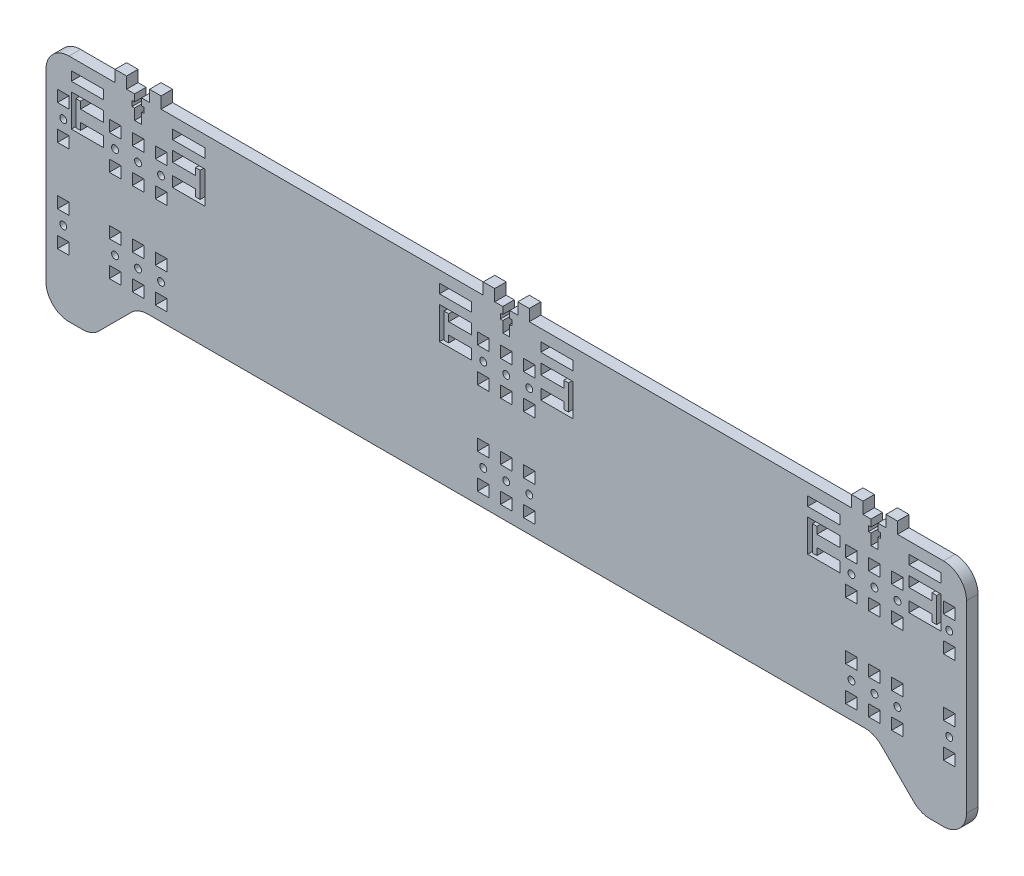
from build123d import *

# Parameters (mm, degrees)
SKETCH1_R           = 1.5
SKETCH1_W           = 5
SKETCH1_H           = 5
SKETCH1_W_2         = 14
SKETCH1_H_2         = 4
BOSS_EXTRUDE1_DEPTH = 5
CONG_1_R            = 10


with BuildPart() as part:
    # Sketch1 → Boss-Extrude1 (new body)
    with BuildSketch(Plane.XY):
        Polygon((1.5, 0), (5, 0), (5, 5), (10, 5), (10, 0), (150, 0), (150, 5), (155, 5), (155, 0), (158.5, 0), (158.5, -3), (157.4, -3), (157.4, -5.3), (158.5, -5.3), (158.5, -10), (161.5, -10), (161.5, -5.3), (162.6, -5.3), (162.6, -3), (161.5, -3), (161.5, 0), (165, 0), (165, 5), (170, 5), (170, 0), (200, 0), (200, -100), (180, -100), (160, -80), (-160, -80), (-180, -100), (-200, -100), (-200, 0), (-170, 0), (-170, 5), (-165, 5), (-165, 0), (-161.5, 0), (-161.5, -3), (-162.6, -3), (-162.6, -5.3), (-161.5, -5.3), (-161.5, -10), (-158.5, -10), (-158.5, -5.3), (-157.4, -5.3), (-157.4, -3), (-158.5, -3), (-158.5, 0), (-155, 0), (-155, 5), (-150, 5), (-150, 0), (-10, 0), (-10, 5), (-5, 5), (-5, 0), (-1.5, 0), (-1.5, -3), (-2.6, -3), (-2.6, -5.3), (-1.5, -5.3), (-1.5, -10), (1.5, -10), (1.5, -5.3), (2.6, -5.3), (2.6, -3), (1.5, -3), align=None)
        with Locations((150, -65)):
            Circle(SKETCH1_R, mode=Mode.SUBTRACT)
        with Locations((10, -65)):
            Circle(SKETCH1_R, mode=Mode.SUBTRACT)
        with Locations((-150, -65)):
            Circle(SKETCH1_R, mode=Mode.SUBTRACT)
        with Locations((-150, -25)):
            Circle(SKETCH1_R, mode=Mode.SUBTRACT)
        with Locations((10, -25)):
            Circle(SKETCH1_R, mode=Mode.SUBTRACT)
        with Locations((150, -25)):
            Circle(SKETCH1_R, mode=Mode.SUBTRACT)
        with Locations((192.5, -25)):
            Circle(SKETCH1_R, mode=Mode.SUBTRACT)
        with Locations((192.5, -65)):
            Circle(SKETCH1_R, mode=Mode.SUBTRACT)
        with Locations((-192.5, -65)):
            Circle(SKETCH1_R, mode=Mode.SUBTRACT)
        with Locations((-192.5, -25)):
            Circle(SKETCH1_R, mode=Mode.SUBTRACT)
        with Locations((170, -25)):
            Circle(SKETCH1_R, mode=Mode.SUBTRACT)
        with Locations((170, -65)):
            Circle(SKETCH1_R, mode=Mode.SUBTRACT)
        with Locations(Location((-10, -65, 0), (0, 0, 180))):
            Circle(SKETCH1_R, mode=Mode.SUBTRACT)
        with Locations(Location((-10, -25, 0), (0, 0, 180))):
            Circle(SKETCH1_R, mode=Mode.SUBTRACT)
        with Locations(Location((-170, -65, 0), (0, 0, 180))):
            Circle(SKETCH1_R, mode=Mode.SUBTRACT)
        with Locations(Location((-170, -25, 0), (0, 0, 180))):
            Circle(SKETCH1_R, mode=Mode.SUBTRACT)
        with Locations((0, -65)):
            Circle(SKETCH1_R, mode=Mode.SUBTRACT)
        with Locations((0, -25)):
            Circle(SKETCH1_R, mode=Mode.SUBTRACT)
        with Locations((-160, -25)):
            Circle(SKETCH1_R, mode=Mode.SUBTRACT)
        with Locations((-160, -65)):
            Circle(SKETCH1_R, mode=Mode.SUBTRACT)
        with Locations((160, -25)):
            Circle(SKETCH1_R, mode=Mode.SUBTRACT)
        with Locations((160, -65)):
            Circle(SKETCH1_R, mode=Mode.SUBTRACT)
        with Locations((150, -57.5)):
            Rectangle(SKETCH1_W, SKETCH1_H, mode=Mode.SUBTRACT)
        with Locations((150, -72.5)):
            Rectangle(SKETCH1_W, SKETCH1_H, mode=Mode.SUBTRACT)
        with Locations((10, -57.5)):
            Rectangle(SKETCH1_W, SKETCH1_H, mode=Mode.SUBTRACT)
        with Locations((10, -72.5)):
            Rectangle(SKETCH1_W, SKETCH1_H, mode=Mode.SUBTRACT)
        with Locations((-150, -57.5)):
            Rectangle(SKETCH1_W, SKETCH1_H, mode=Mode.SUBTRACT)
        with Locations((-150, -72.5)):
            Rectangle(SKETCH1_W, SKETCH1_H, mode=Mode.SUBTRACT)
        with Locations((-150, -17.5)):
            Rectangle(SKETCH1_W, SKETCH1_H, mode=Mode.SUBTRACT)
        with Locations((-150, -32.5)):
            Rectangle(SKETCH1_W, SKETCH1_H, mode=Mode.SUBTRACT)
        with Locations((10, -17.5)):
            Rectangle(SKETCH1_W, SKETCH1_H, mode=Mode.SUBTRACT)
        with Locations((10, -32.5)):
            Rectangle(SKETCH1_W, SKETCH1_H, mode=Mode.SUBTRACT)
        with Locations((150, -17.5)):
            Rectangle(SKETCH1_W, SKETCH1_H, mode=Mode.SUBTRACT)
        with Locations((150, -32.5)):
            Rectangle(SKETCH1_W, SKETCH1_H, mode=Mode.SUBTRACT)
        with Locations((192.5, -17.5)):
            Rectangle(SKETCH1_W, SKETCH1_H, mode=Mode.SUBTRACT)
        with Locations((192.5, -32.5)):
            Rectangle(SKETCH1_W, SKETCH1_H, mode=Mode.SUBTRACT)
        with Locations((192.5, -57.5)):
            Rectangle(SKETCH1_W, SKETCH1_H, mode=Mode.SUBTRACT)
        with Locations((192.5, -72.5)):
            Rectangle(SKETCH1_W, SKETCH1_H, mode=Mode.SUBTRACT)
        with Locations((-192.5, -57.5)):
            Rectangle(SKETCH1_W, SKETCH1_H, mode=Mode.SUBTRACT)
        with Locations((-192.5, -72.5)):
            Rectangle(SKETCH1_W, SKETCH1_H, mode=Mode.SUBTRACT)
        with Locations((-192.5, -17.5)):
            Rectangle(SKETCH1_W, SKETCH1_H, mode=Mode.SUBTRACT)
        with Locations((-192.5, -32.5)):
            Rectangle(SKETCH1_W, SKETCH1_H, mode=Mode.SUBTRACT)
        with Locations((170, -17.5)):
            Rectangle(SKETCH1_W, SKETCH1_H, mode=Mode.SUBTRACT)
        with Locations((170, -32.5)):
            Rectangle(SKETCH1_W, SKETCH1_H, mode=Mode.SUBTRACT)
        with Locations((170, -57.5)):
            Rectangle(SKETCH1_W, SKETCH1_H, mode=Mode.SUBTRACT)
        with Locations((170, -72.5)):
            Rectangle(SKETCH1_W, SKETCH1_H, mode=Mode.SUBTRACT)
        with Locations((-10, -57.5)):
            Rectangle(SKETCH1_W, SKETCH1_H, mode=Mode.SUBTRACT)
        with Locations((-10, -72.5)):
            Rectangle(SKETCH1_W, SKETCH1_H, mode=Mode.SUBTRACT)
        with Locations((-10, -17.5)):
            Rectangle(SKETCH1_W, SKETCH1_H, mode=Mode.SUBTRACT)
        with Locations((-10, -32.5)):
            Rectangle(SKETCH1_W, SKETCH1_H, mode=Mode.SUBTRACT)
        with Locations((-170, -57.5)):
            Rectangle(SKETCH1_W, SKETCH1_H, mode=Mode.SUBTRACT)
        with Locations((-170, -72.5)):
            Rectangle(SKETCH1_W, SKETCH1_H, mode=Mode.SUBTRACT)
        with Locations((-170, -17.5)):
            Rectangle(SKETCH1_W, SKETCH1_H, mode=Mode.SUBTRACT)
        with Locations((-170, -32.5)):
            Rectangle(SKETCH1_W, SKETCH1_H, mode=Mode.SUBTRACT)
        Polygon((-145, -17.5), (-135, -17.5), (-135, -14.5), (-133, -14.5), (-133, -25.5), (-135, -25.5), (-135, -22.5), (-145, -22.5), (-145, -27), (-131, -27), (-131, -13), (-145, -13), align=None, mode=Mode.SUBTRACT)
        with Locations((-138, -7)):
            Rectangle(SKETCH1_W_2, SKETCH1_H_2, mode=Mode.SUBTRACT)
        Polygon((15, -17.5), (25, -17.5), (25, -14.5), (27, -14.5), (27, -25.5), (25, -25.5), (25, -22.5), (15, -22.5), (15, -27), (29, -27), (29, -13), (15, -13), align=None, mode=Mode.SUBTRACT)
        with Locations((22, -7)):
            Rectangle(SKETCH1_W_2, SKETCH1_H_2, mode=Mode.SUBTRACT)
        Polygon((175, -17.5), (185, -17.5), (185, -14.5), (187, -14.5), (187, -25.5), (185, -25.5), (185, -22.5), (175, -22.5), (175, -27), (189, -27), (189, -13), (175, -13), align=None, mode=Mode.SUBTRACT)
        with Locations((182, -7)):
            Rectangle(SKETCH1_W_2, SKETCH1_H_2, mode=Mode.SUBTRACT)
        Polygon((145, -17.5), (135, -17.5), (135, -14.5), (133, -14.5), (133, -25.5), (135, -25.5), (135, -22.5), (145, -22.5), (145, -27), (131, -27), (131, -13), (145, -13), align=None, mode=Mode.SUBTRACT)
        with Locations((138, -7)):
            Rectangle(SKETCH1_W_2, SKETCH1_H_2, mode=Mode.SUBTRACT)
        Polygon((-15, -17.5), (-25, -17.5), (-25, -14.5), (-27, -14.5), (-27, -25.5), (-25, -25.5), (-25, -22.5), (-15, -22.5), (-15, -27), (-29, -27), (-29, -13), (-15, -13), align=None, mode=Mode.SUBTRACT)
        with Locations((-22, -7)):
            Rectangle(SKETCH1_W_2, SKETCH1_H_2, mode=Mode.SUBTRACT)
        Polygon((-175, -17.5), (-185, -17.5), (-185, -14.5), (-187, -14.5), (-187, -25.5), (-185, -25.5), (-185, -22.5), (-175, -22.5), (-175, -27), (-189, -27), (-189, -13), (-175, -13), align=None, mode=Mode.SUBTRACT)
        with Locations((-182, -7)):
            Rectangle(SKETCH1_W_2, SKETCH1_H_2, mode=Mode.SUBTRACT)
        with Locations((0, -57.5)):
            Rectangle(SKETCH1_W, SKETCH1_H, mode=Mode.SUBTRACT)
        with Locations((0, -72.5)):
            Rectangle(SKETCH1_W, SKETCH1_H, mode=Mode.SUBTRACT)
        with Locations((0, -17.5)):
            Rectangle(SKETCH1_W, SKETCH1_H, mode=Mode.SUBTRACT)
        with Locations((0, -32.5)):
            Rectangle(SKETCH1_W, SKETCH1_H, mode=Mode.SUBTRACT)
        with Locations((-160, -17.5)):
            Rectangle(SKETCH1_W, SKETCH1_H, mode=Mode.SUBTRACT)
        with Locations((-160, -32.5)):
            Rectangle(SKETCH1_W, SKETCH1_H, mode=Mode.SUBTRACT)
        with Locations((-160, -57.5)):
            Rectangle(SKETCH1_W, SKETCH1_H, mode=Mode.SUBTRACT)
        with Locations((-160, -72.5)):
            Rectangle(SKETCH1_W, SKETCH1_H, mode=Mode.SUBTRACT)
        with Locations((160, -17.5)):
            Rectangle(SKETCH1_W, SKETCH1_H, mode=Mode.SUBTRACT)
        with Locations((160, -32.5)):
            Rectangle(SKETCH1_W, SKETCH1_H, mode=Mode.SUBTRACT)
        with Locations((160, -57.5)):
            Rectangle(SKETCH1_W, SKETCH1_H, mode=Mode.SUBTRACT)
        with Locations((160, -72.5)):
            Rectangle(SKETCH1_W, SKETCH1_H, mode=Mode.SUBTRACT)
    extrude(amount=BOSS_EXTRUDE1_DEPTH)

    # Congé1
    cong_1_edges = [part.edges().sort_by_distance(p)[0] for p in [
        (200, 0, 2.5),
        (200, -100, 2.5),
        (180, -100, 2.5),
        (160, -80, 2.5),
        (-160, -80, 2.5),
        (-180, -100, 2.5),
        (-200, -100, 2.5),
        (-200, 0, 2.5),
    ]]
    fillet(cong_1_edges, radius=CONG_1_R)


solid = part.part
